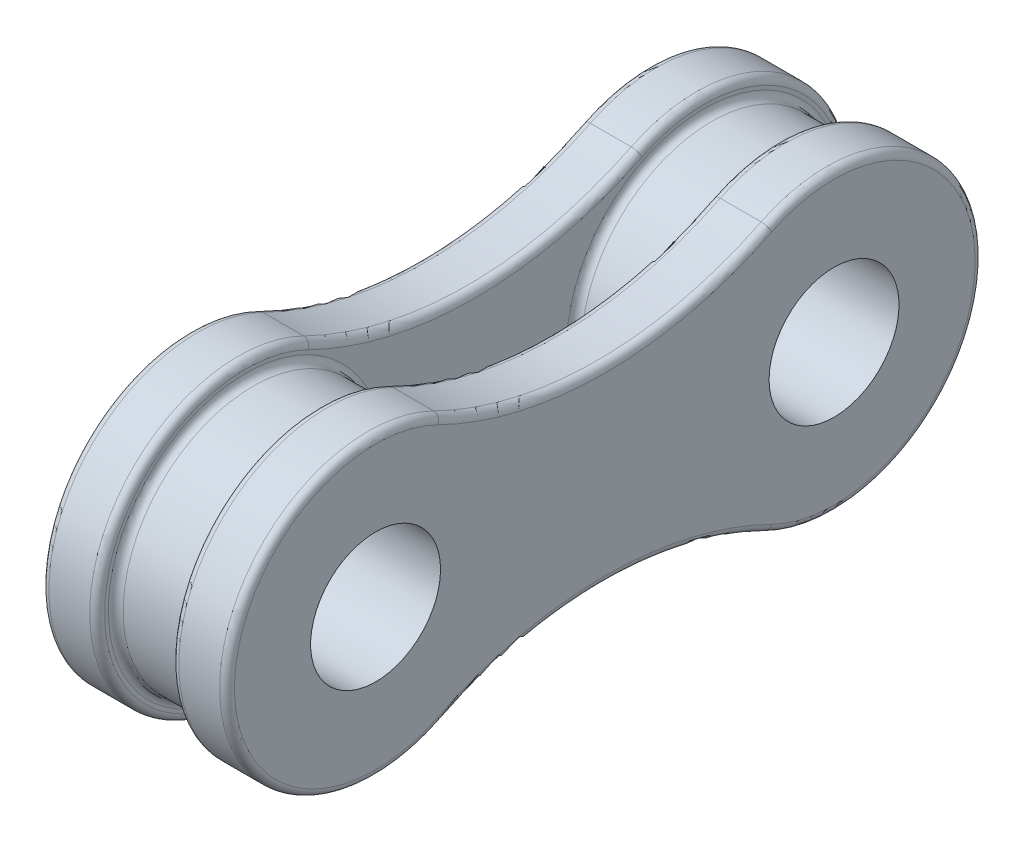
from build123d import *

# Parameters (mm, degrees)
SALIENTE_EXTRUIR1_START      = 1
CROQUIS1_R                   = 1.75
SALIENTE_EXTRUIR1_DEPTH      = 1.5
SALIENTE_EXTRUIR2_START      = -1
CROQUIS2_R                   = 1.75
SALIENTE_EXTRUIR2_DEPTH      = 1.5
SALIENTE_EXTRUIR3_DEPTH      = 1
SALIENTE_EXTRUIR3_DEPTH_BACK = 2.5
CROQUIS3_R                   = 3.5
CROQUIS3_R_2                 = 1.75
REDONDEO1_R                  = 0.2


with BuildPart() as part:
    # Croquis1 → Saliente-Extruir1 (new body)
    with BuildSketch(Plane(origin=(0, 0, 0), x_dir=(0, 0, -1), z_dir=(1, 0, 0)).offset(SALIENTE_EXTRUIR1_START)):
        with BuildLine():
            ThreePointArc((-4.410714286, 3.589888009), (-10.175, 0), (-4.410714286, -3.589888009))
            ThreePointArc((-4.410714286, -3.589888009), (0, -2.564608032), (4.410714286, -3.589888009))
            ThreePointArc((4.410714286, -3.589888009), (10.175, 0), (4.410714286, 3.589888009))
            ThreePointArc((4.410714286, 3.589888009), (0, 2.564608032), (-4.410714286, 3.589888009))
        make_face()
        with Locations((-6.175, 0)):
            Circle(CROQUIS1_R, mode=Mode.SUBTRACT)
        with Locations(Location((6.175, 0, 0), (0, 0, 180))):
            Circle(CROQUIS1_R, mode=Mode.SUBTRACT)
    extrude(amount=SALIENTE_EXTRUIR1_DEPTH)



with BuildPart() as body_2:
    # Croquis2 → Saliente-Extruir2 (new body)
    with BuildSketch(Plane(origin=(0, 0, 0), x_dir=(0, 0, -1), z_dir=(1, 0, 0)).offset(SALIENTE_EXTRUIR2_START)):
        with BuildLine():
            ThreePointArc((-4.410714286, 3.589888009), (0, 2.564608032), (4.410714286, 3.589888009))
            ThreePointArc((4.410714286, 3.589888009), (10.175, 0), (4.410714286, -3.589888009))
            ThreePointArc((4.410714286, -3.589888009), (0, -2.564608032), (-4.410714286, -3.589888009))
            ThreePointArc((-4.410714286, -3.589888009), (-10.175, 0), (-4.410714286, 3.589888009))
        make_face()
        with Locations(Location((6.175, 0, 0), (0, 0, 180))):
            Circle(CROQUIS2_R, mode=Mode.SUBTRACT)
        with Locations((-6.175, 0)):
            Circle(CROQUIS2_R, mode=Mode.SUBTRACT)
    extrude(amount=-SALIENTE_EXTRUIR2_DEPTH)


with BuildPart() as part_1:
    add(part.part)

    add(body_2.part)  # Saliente-Extruir3 merges body 2
    # Croquis3 → Saliente-Extruir3 (add, two sides: drawn at the far end of the back side and taken through both)
    # profile 1 of 2: a face of its own
    with BuildSketch(Plane(origin=(0, 0, 0), x_dir=(0, 0, -1), z_dir=(1, 0, 0)).offset(-SALIENTE_EXTRUIR3_DEPTH_BACK)):
        with Locations((-6.175, 0)):
            Circle(CROQUIS3_R)
        with Locations((-6.175, 0)):
            Circle(CROQUIS3_R_2, mode=Mode.SUBTRACT)
    # profile 2 of 2: a face of its own
    with BuildSketch(Plane(origin=(0, 0, 0), x_dir=(0, 0, -1), z_dir=(1, 0, 0)).offset(-SALIENTE_EXTRUIR3_DEPTH_BACK)):
        with Locations((6.175, 0)):
            Circle(CROQUIS3_R)
        with Locations(Location((6.175, 0, 0), (0, 0, 180))):
            Circle(CROQUIS3_R_2, mode=Mode.SUBTRACT)
    extrude(amount=SALIENTE_EXTRUIR3_DEPTH + SALIENTE_EXTRUIR3_DEPTH_BACK)

    # Redondeo1
    redondeo1_edges = [part_1.edges().sort_by_distance(p)[0] for p in [
        (2.5, -2.564608032, 0),
        (2.5, 0, -10.175),
        (-1, 0, -2.675),
        (1, 0, -2.675),
        (-2.5, 0, 10.175),
        (-2.5, 2.564608032, 0),
        (-2.5, 0, -10.175),
        (-2.5, -2.564608032, 0),
        (-2.5, 0, 7.925),
        (-2.5, 0, -7.925),
        (-1, 0, 10.175),
        (-1, -2.564608032, 0),
        (-1, 0, -10.175),
        (-1, 2.564608032, 0),
        (-1, 0, 9.675),
        (1, 0, 9.675),
        (2.5, 2.564608032, 0),
        (1, 0, -10.175),
        (1, -2.564608032, 0),
        (1, 0, 10.175),
        (1, 2.564608032, 0),
        (2.5, 0, 10.175),
    ]]
    fillet(redondeo1_edges, radius=REDONDEO1_R)


solid = part_1.part
